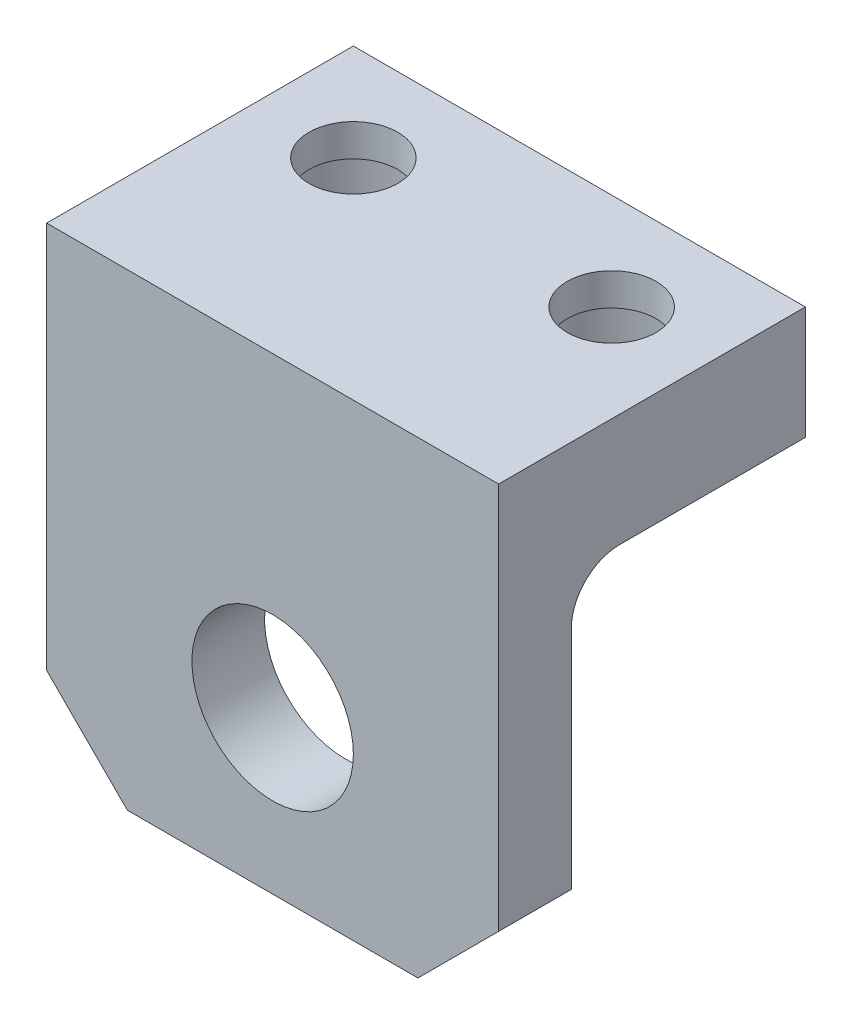
from build123d import *

# Parameters (mm, degrees)
SKETCH_1_W                  = 28
SKETCH_1_H                  = 19
EXTRUDE_1_DEPTH             = 29
CUT_EXTRUDE_1_DEPTH         = 42.41557678
HOLE_WIZARD_1_D             = 10
HOLE_WIZARD_1_2_D           = 5.5
HOLE_WIZARD_1_2_CBORE_D     = 10
HOLE_WIZARD_1_2_CBORE_DEPTH = 5
CHAMFER_1_SIZE              = 5


with BuildPart() as part:
    # 草图1 → 凸台-拉伸1 (new body)
    with BuildSketch(Plane(origin=(0, 0, 0), x_dir=(1, 0, 0), z_dir=(0, 1, 0))):
        Rectangle(SKETCH_1_W, SKETCH_1_H)
    extrude(amount=-EXTRUDE_1_DEPTH)

    # 草图2 → 切除-拉伸1 (cut, through all)
    with BuildSketch(Plane(origin=(14, 0, 0), x_dir=(0, 0, -1), z_dir=(1, 0, 0))):
        with BuildLine():
            Line((9.5, -29), (-5, -29))
            Line((-5, -29), (-5, -10))
            ThreePointArc((-5, -10), (-4.121320344, -7.878679656), (-2, -7))
            Line((-2, -7), (9.5, -7))
            Line((9.5, -7), (9.5, -29))
        make_face()
    extrude(amount=-CUT_EXTRUDE_1_DEPTH, mode=Mode.SUBTRACT)

    # Hole Wizard 1 (through all)
    with Locations(Plane.XY.offset(9.5)):
        with Locations((0, -19)):
            Hole(HOLE_WIZARD_1_D / 2)

    # Hole Wizard 1 2 (through all)
    with Locations(Plane(origin=(0, -7, 0), x_dir=(-1, 0, 0), z_dir=(0, -1, 0))):
        with Locations((8, 3.5), (-8, 3.5)):
            CounterBoreHole(HOLE_WIZARD_1_2_D / 2, HOLE_WIZARD_1_2_CBORE_D / 2, HOLE_WIZARD_1_2_CBORE_DEPTH)

    # 倒角1
    chamfer_1_edges = [part.edges().sort_by_distance(p)[0] for p in [
        (-14, -29, 7.25),
        (14, -29, 7.25),
    ]]
    chamfer(chamfer_1_edges, length=CHAMFER_1_SIZE)


solid = part.part
